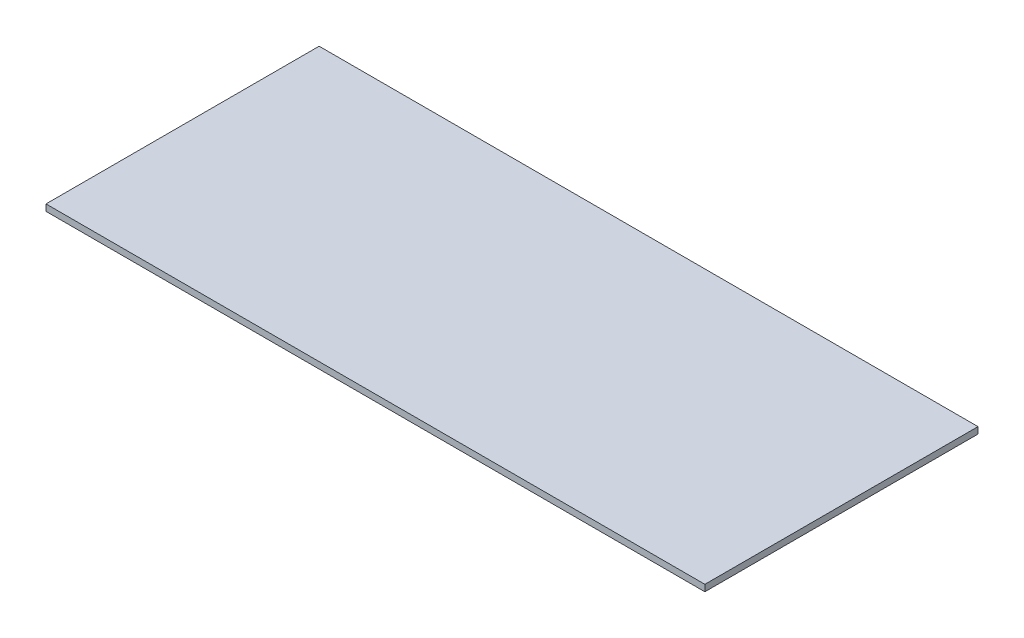
from build123d import *

# Parameters (mm, degrees)
SKETCH1_W           = 1289.6
SKETCH1_H           = 534.6
BOSS_EXTRUDE1_DEPTH = 12.7


with BuildPart() as part:
    # Sketch1 → Boss-Extrude1 (new body)
    with BuildSketch(Plane(origin=(0, 0, 0), x_dir=(1, 0, 0), z_dir=(0, 1, 0))):
        with Locations((644.8, 267.3)):
            Rectangle(SKETCH1_W, SKETCH1_H)
    extrude(amount=BOSS_EXTRUDE1_DEPTH)


solid = part.part
